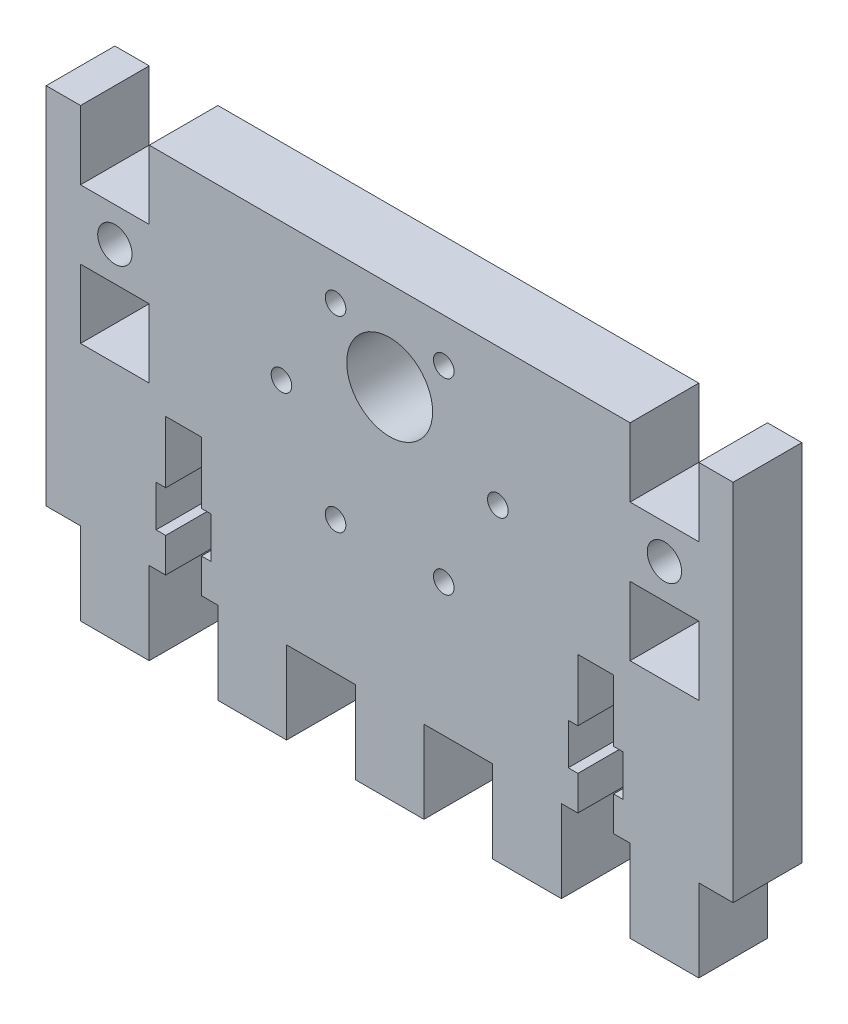
from build123d import *

# Parameters (mm, degrees)
SKETCH1_W           = 100
SKETCH1_H           = 65
BOSS_EXTRUDE1_DEPTH = 10
SKETCH2_R           = 1.5
SKETCH2_R_2         = 6.25
CUT_EXTRUDE1_DEPTH  = 61.466933112
SKETCH3_W           = 10
SKETCH3_H           = 12
CUT_EXTRUDE2_DEPTH  = 61.466933112
LPATTERN1_COUNT     = 4
LPATTERN1_PITCH     = 20
SKETCH4_W           = 5
SKETCH4_H           = 12
CUT_EXTRUDE3_DEPTH  = 61.466933112
SKETCH6_R           = 2.5
SKETCH6_W           = 10
SKETCH6_H           = 10
CUT_EXTRUDE4_DEPTH  = 61.466933112


with BuildPart() as part:
    # Sketch1 → Boss-Extrude1 (new body)
    with BuildSketch(Plane.XY):
        Rectangle(SKETCH1_W, SKETCH1_H)
    extrude(amount=BOSS_EXTRUDE1_DEPTH)

    # Sketch2 → Cut-Extrude1 (cut, through all)
    with BuildSketch(Plane.XY.offset(10)):
        with Locations((-15.75, 12.5)):
            Circle(SKETCH2_R)
        with Locations((-7.875, 26.13990011)):
            Circle(SKETCH2_R)
        with Locations((7.875, 26.13990011)):
            Circle(SKETCH2_R)
        with Locations((15.75, 12.5)):
            Circle(SKETCH2_R)
        with Locations((7.875, -1.13990011)):
            Circle(SKETCH2_R)
        with Locations((-7.875, -1.13990011)):
            Circle(SKETCH2_R)
        with Locations((0, 19.5)):
            Circle(SKETCH2_R_2)
    extrude(amount=-CUT_EXTRUDE1_DEPTH, mode=Mode.SUBTRACT)

    # Sketch3 → Cut-Extrude2 (cut, through all)
    with BuildSketch(Plane.XY.offset(10)):
        with Locations((-30, -26.5)):
            Rectangle(SKETCH3_W, SKETCH3_H)
    cut_extrude2 = extrude(amount=-CUT_EXTRUDE2_DEPTH, mode=Mode.SUBTRACT)

    # LPattern1: Cut-Extrude2 ×4
    with Locations(*[(i * LPATTERN1_PITCH, 0, 0) for i in range(1, LPATTERN1_COUNT)]):
        add(cut_extrude2, mode=Mode.SUBTRACT)

    # Sketch4 → Cut-Extrude3 (cut, through all)
    with BuildSketch(Plane.XY.offset(10)):
        with Locations((-47.5, -26.5)):
            Rectangle(SKETCH4_W, SKETCH4_H)
        Polygon((-34, -9.5), (-34, -15.5), (-32.6, -15.5), (-32.6, -20.5), (-27.4, -20.5), (-27.4, -15.5), (-26, -15.5), (-26, -9.5), (-27.4, -9.5), (-27.4, -0.5), (-32.6, -0.5), (-32.6, -9.5), align=None)
    cut_extrude3 = extrude(amount=-CUT_EXTRUDE3_DEPTH, mode=Mode.SUBTRACT)

    # Sketch6 → Cut-Extrude4 (cut, through all)
    with BuildSketch(Plane.XY.offset(10)):
        with Locations((-40, 17.5)):
            Circle(SKETCH6_R)
        with Locations((-40, 27.5)):
            Rectangle(SKETCH6_W, SKETCH6_H)
        with Locations((-40, 7.5)):
            Rectangle(SKETCH6_W, SKETCH6_H)
    cut_extrude4 = extrude(amount=-CUT_EXTRUDE4_DEPTH, mode=Mode.SUBTRACT)

    # Mirror1: Cut-Extrude3, Cut-Extrude4 across plane
    add(cut_extrude3.mirror(Plane(origin=(0, 0, 0), x_dir=(0, 0, 1), z_dir=(1, 0, 0))), mode=Mode.SUBTRACT)
    add(cut_extrude4.mirror(Plane(origin=(0, 0, 0), x_dir=(0, 0, 1), z_dir=(1, 0, 0))), mode=Mode.SUBTRACT)


solid = part.part
